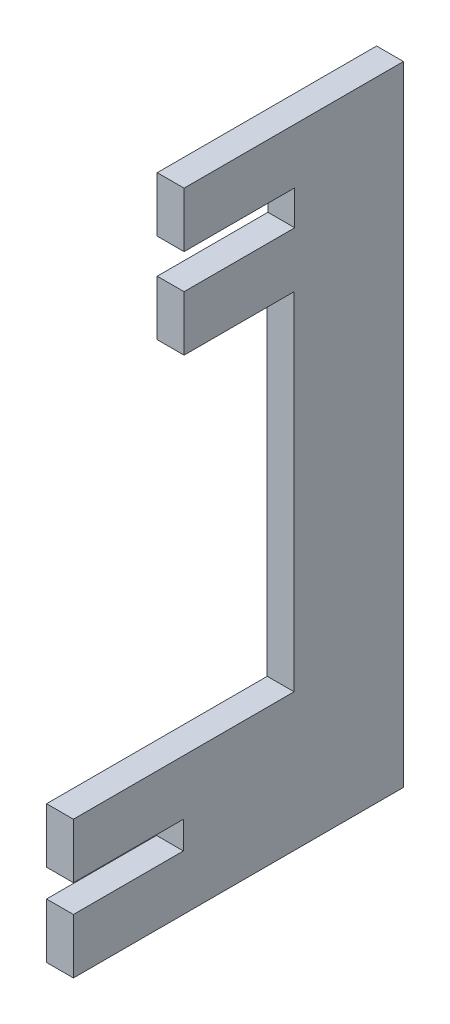
from build123d import *

# Parameters (mm, degrees)
BOSS_EXTRUDE1_DEPTH = 3.0988


with BuildPart() as part:
    # Sketch1 → Boss-Extrude1 (new body)
    with BuildSketch(Plane(origin=(0, 0, 0), x_dir=(0, 0, -1), z_dir=(1, 0, 0))):
        Polygon((-12.7, -1.5875), (-12.7, -7.9375), (25.4, -7.9375), (25.4, 64.6375), (0.0762, 64.6375), (0.0762, 58.2875), (12.8524, 58.2875), (12.8524, 54.2875), (0.0762, 54.2875), (0.0762, 47.9375), (12.7762, 47.9375), (12.7762, 7.9375), (-12.7, 7.9375), (-12.7, 1.5875), (0, 1.5875), (0, -1.5875), align=None)
    extrude(amount=BOSS_EXTRUDE1_DEPTH)


solid = part.part
